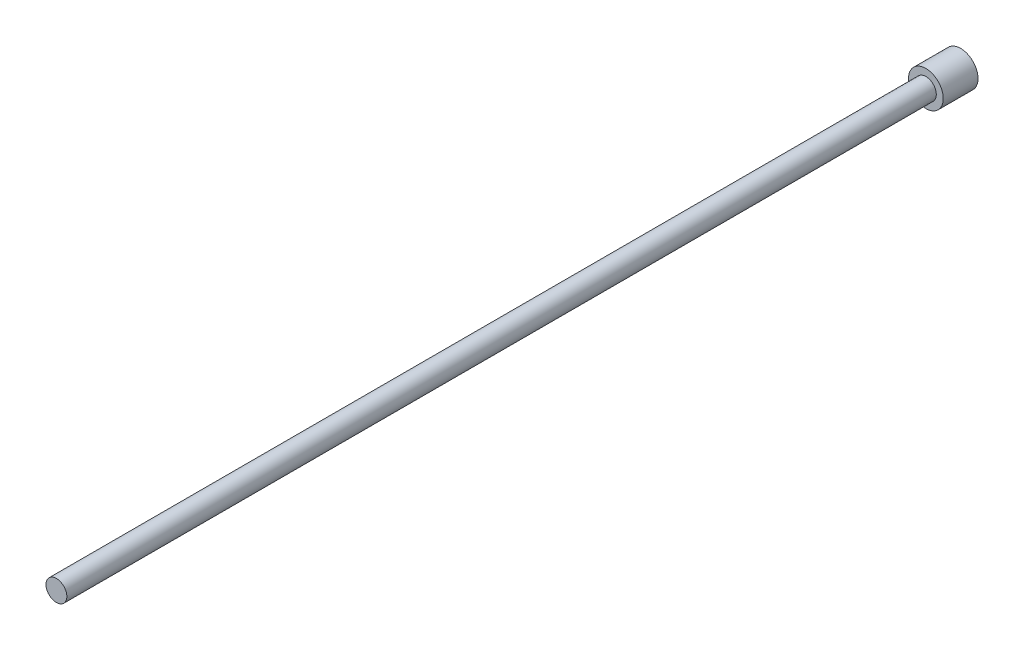
from build123d import *

# Parameters (mm, degrees)
CROQUIS1_R              = 0.6
SALIENTE_EXTRUIR1_DEPTH = 50
CROQUIS2_R              = 1
SALIENTE_EXTRUIR2_DEPTH = 2


with BuildPart() as part:
    # Croquis1 → Saliente-Extruir1 (new body)
    with BuildSketch(Plane.XY):
        Circle(CROQUIS1_R)
    extrude(amount=SALIENTE_EXTRUIR1_DEPTH)

    # Croquis2 → Saliente-Extruir2 (add)
    with BuildSketch(Plane(origin=(0, 0, 0), x_dir=(-1, 0, 0), z_dir=(0, 0, -1))):
        Circle(CROQUIS2_R)
    extrude(amount=SALIENTE_EXTRUIR2_DEPTH)


solid = part.part
